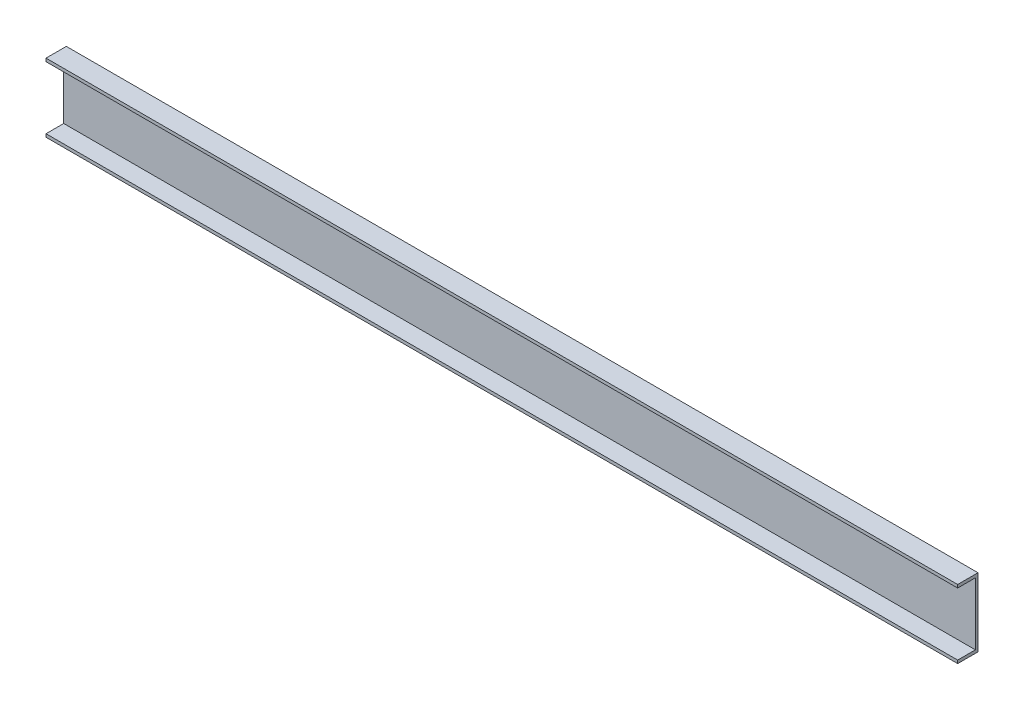
from build123d import *

# Parameters (mm, degrees)
SKETCH_1_W        = 3990
SKETCH_1_H        = 300
EXTRUDE_629_DEPTH = 11.5
SKETCH_2_W        = 3990
SKETCH_2_H        = 13.5
EXTRUDE_1_DEPTH   = 77.5
SKETCH_3_W        = 70
SKETCH_3_H        = 230
EXTRUDE_2_DEPTH   = 16


with BuildPart() as part:
    # 草图1 → Extrude 629 (new body)
    with BuildSketch(Plane.XY):
        Rectangle(SKETCH_1_W, SKETCH_1_H)
    extrude(amount=EXTRUDE_629_DEPTH)

    # 草图2 → 凸台-拉伸1 (add)
    with BuildSketch(Plane.XY.offset(11.5)):
        with Locations((0, 143.25)):
            Rectangle(SKETCH_2_W, SKETCH_2_H)
        with Locations((0, -143.25)):
            Rectangle(SKETCH_2_W, SKETCH_2_H)
    extrude(amount=EXTRUDE_1_DEPTH)

    # 草图3 → 凸台-拉伸2 (add)
    with BuildSketch(Plane(origin=(0, 0, 0), x_dir=(-1, 0, 0), z_dir=(0, 0, -1))):
        with Locations((-1300, 0)):
            Rectangle(SKETCH_3_W, SKETCH_3_H)
        with Locations((-900, 0)):
            Rectangle(SKETCH_3_W, SKETCH_3_H)
        with Locations((-500, 0)):
            Rectangle(SKETCH_3_W, SKETCH_3_H)
        with Locations((500, 0)):
            Rectangle(SKETCH_3_W, SKETCH_3_H)
        with Locations((900, 0)):
            Rectangle(SKETCH_3_W, SKETCH_3_H)
        with Locations((1300, 0)):
            Rectangle(SKETCH_3_W, SKETCH_3_H)
    extrude(amount=EXTRUDE_2_DEPTH)


solid = part.part
